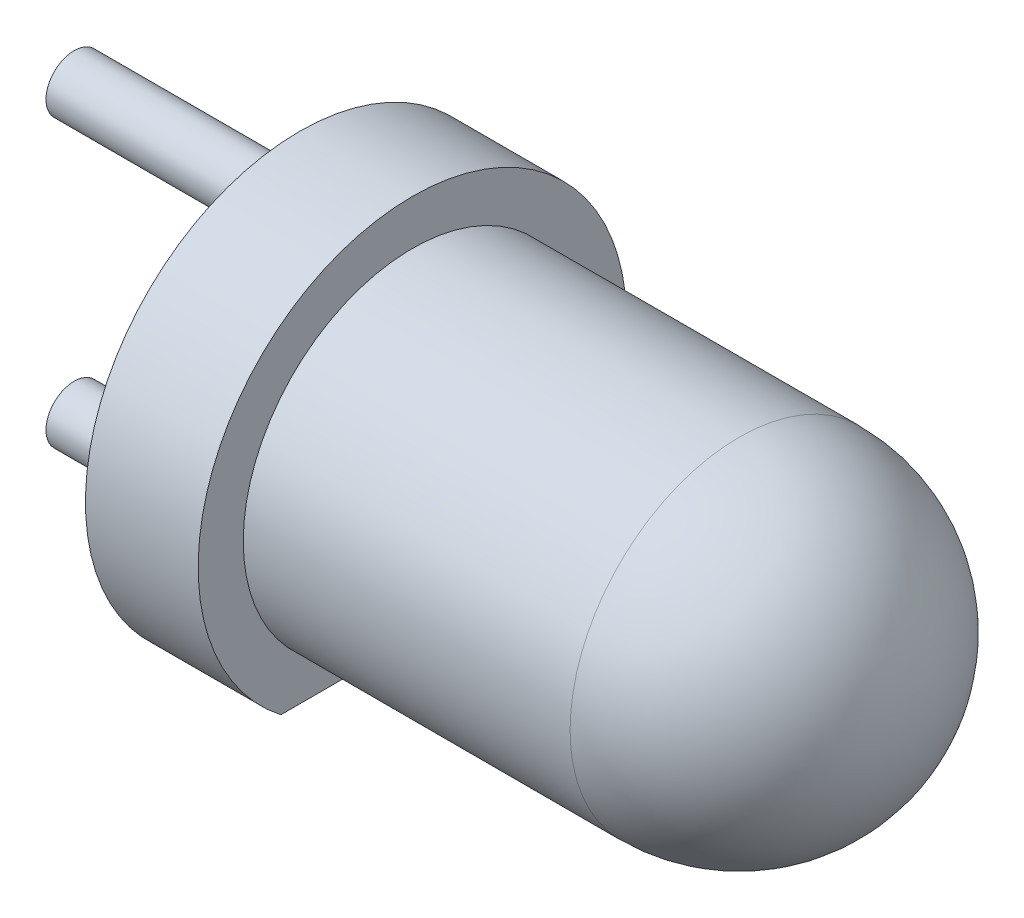
from build123d import *

# Parameters (mm, degrees)
ESQUISSE2_R             = 0.25
EXTRUSION1_DEPTH        = 2
ESQUISSE3_W             = 3.802685038
ESQUISSE3_H             = 0.717288717
ENL_V_MAT_EXTRU_1_DEPTH = 4


with BuildPart() as part:
    # Esquisse1 → Révolution1 (revolve)
    with BuildSketch(Plane.XY, mode=Mode.PRIVATE) as r_volution1_sk:
        with BuildLine():
            Line((0, 0), (4.4, 0))
            ThreePointArc((4.4, 0), (3.960660172, 1.060660172), (2.9, 1.5))
            Line((2.9, 1.5), (0, 1.5))
            Line((0, 1.5), (0, 1.9))
            Line((0, 1.9), (-1, 1.9))
            Line((-1, 1.9), (-1, 0))
            Line((-1, 0), (0, 0))
        make_face()
    revolve(r_volution1_sk.sketch.rotate(Axis((0, 0, 0), (1, 0, 0)), 90), axis=Axis((0, 0, 0), (1, 0, 0)))

    # Esquisse2 → Extrusion1 (add)
    with BuildSketch(Plane.ZY.offset(1)):
        with Locations(Location((0, 1.27, 0), (0, 0, 180))):
            Circle(ESQUISSE2_R)
        with Locations(Location((0, -1.27, 0), (0, 0, 180))):
            Circle(ESQUISSE2_R)
    extrude(amount=EXTRUSION1_DEPTH)

    # Esquisse3 → Enlèv. mat.-Extru.1 (cut)
    with BuildSketch(Plane.ZY.offset(1)):
        with Locations((0.034282181, -1.858644359)):
            Rectangle(ESQUISSE3_W, ESQUISSE3_H)
    extrude(amount=-ENL_V_MAT_EXTRU_1_DEPTH, mode=Mode.SUBTRACT)


solid = part.part
